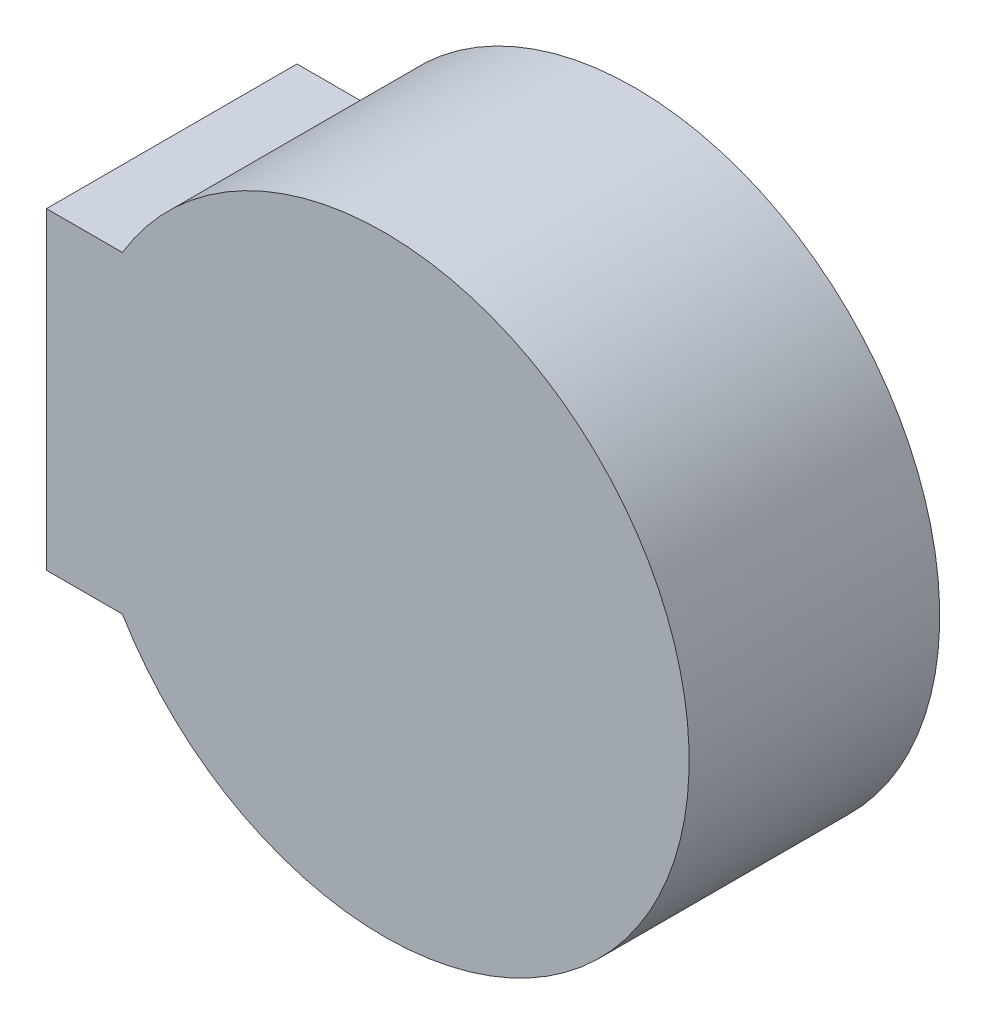
from build123d import *

# Parameters (mm, degrees)
SKETCH1_R           = 14.224
BOSS_EXTRUDE1_DEPTH = 11.684
SKETCH2_W           = 10.862447087
SKETCH2_H           = 14.605
BOSS_EXTRUDE2_DEPTH = 11.684


with BuildPart() as part:
    # Sketch1 → Boss-Extrude1 (new body)
    with BuildSketch(Plane.XY):
        Circle(SKETCH1_R)
    extrude(amount=BOSS_EXTRUDE1_DEPTH)

    # Sketch2 → Boss-Extrude2 (add)
    with BuildSketch(Plane.XY.offset(11.684)):
        with Locations((-10.316776457, 0)):
            Rectangle(SKETCH2_W, SKETCH2_H)
    extrude(amount=-BOSS_EXTRUDE2_DEPTH)


solid = part.part
